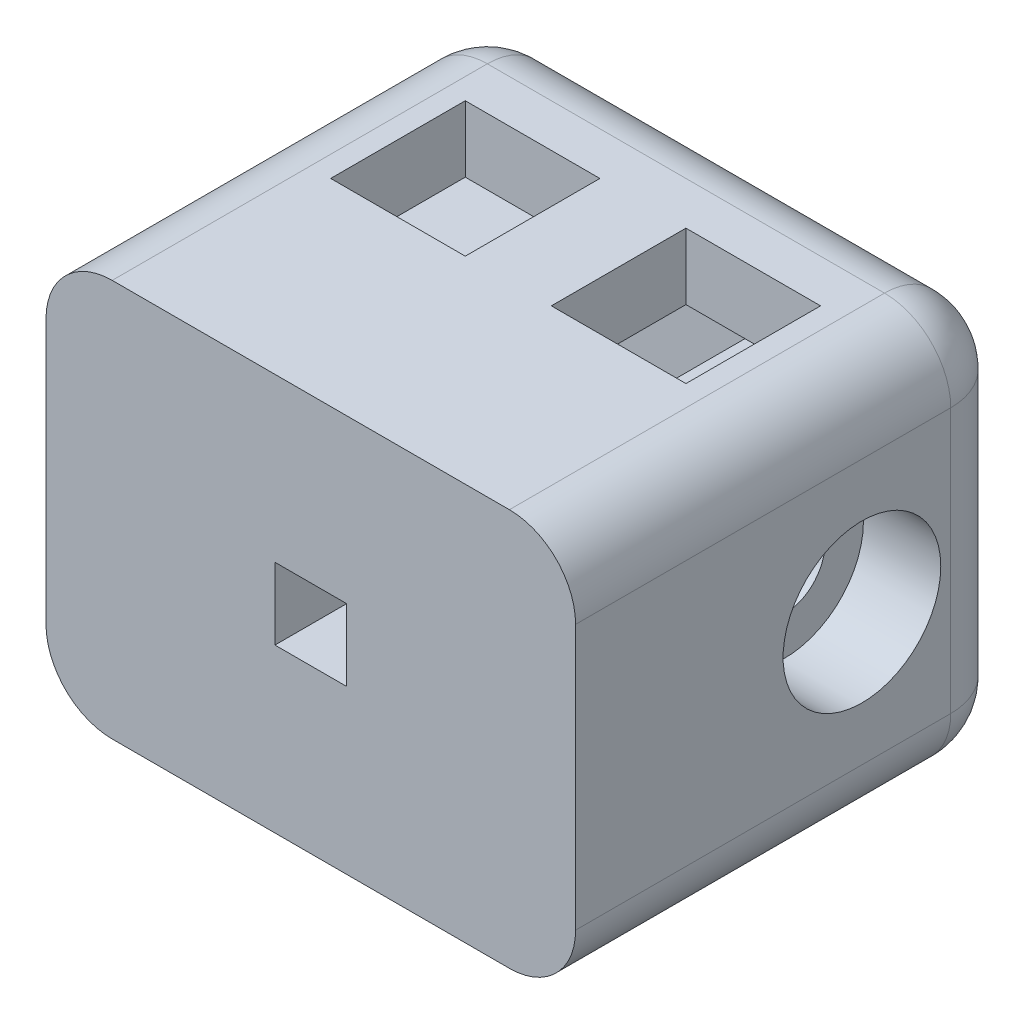
from build123d import *

# Parameters (mm, degrees)
SKETCH1_W                                      = 24
SKETCH1_H                                      = 18
SKETCH1_W_2                                    = 3.25
SKETCH1_H_2                                    = 3.25
BOSS_EXTRUDE1_DEPTH                            = 20
FILLET1_R                                      = 3
SKETCH2_W                                      = 6.1
SKETCH2_H                                      = 6.1
CUT_EXTRUDE1_DEPTH                             = 3
SKETCH3_W                                      = 9.25
SKETCH3_H                                      = 8.1
CUT_EXTRUDE2_DEPTH                             = 28.730849248
SKETCH4_W                                      = 3.25
SKETCH4_H                                      = 3.25
BOSS_EXTRUDE2_DEPTH                            = 2.95
CBORE_FOR_6_SOCKET_HEAD_CAP_SCREW1_D           = 3.6576
CBORE_FOR_6_SOCKET_HEAD_CAP_SCREW1_CBORE_D     = 7.14502
CBORE_FOR_6_SOCKET_HEAD_CAP_SCREW1_CBORE_DEPTH = 3.5052


with BuildPart() as part:
    # Sketch1 → Boss-Extrude1 (new body)
    # profile 1 of 2: a face of its own
    with BuildSketch(Plane.XY):
        Rectangle(SKETCH1_W, SKETCH1_H)
        Rectangle(SKETCH1_W_2, SKETCH1_H_2, mode=Mode.SUBTRACT)
    # profile 2 of 2: a face of its own
    with BuildSketch(Plane.XY):
        Polygon((-1.625, -1.625), (-1.625, 1.625), (-1.625, 4), (-4.8, 4), (-4.8, -4), (-1.625, -4), align=None)
    extrude(amount=BOSS_EXTRUDE1_DEPTH)

    # Fillet1
    fillet1_edges = [part.edges().sort_by_distance(p)[0] for p in [
        (12, 0, 0),
        (0, -9, 0),
        (-12, -9, 10),
        (-12, 9, 10),
        (12, 9, 10),
        (12, -9, 10),
        (-12, 0, 0),
        (0, 9, 0),
    ]]
    fillet(fillet1_edges, radius=FILLET1_R)

    # Sketch2 → Cut-Extrude1 (cut)
    with BuildSketch(Plane(origin=(0, 9, 0), x_dir=(1, 0, 0), z_dir=(0, 1, 0))):
        with Locations((-5, -8)):
            Rectangle(SKETCH2_W, SKETCH2_H)
        with Locations((5, -8)):
            Rectangle(SKETCH2_W, SKETCH2_H)
    extrude(amount=-CUT_EXTRUDE1_DEPTH, mode=Mode.SUBTRACT)

    # Sketch3 → Cut-Extrude2 (cut, through all)
    with BuildSketch(Plane(origin=(0, 6, 0), x_dir=(1, 0, 0), z_dir=(0, 1, 0))):
        with Locations((0, -7)):
            Rectangle(SKETCH3_W, SKETCH3_H)
    extrude(amount=-CUT_EXTRUDE2_DEPTH, mode=Mode.SUBTRACT)

    # Sketch4 → Boss-Extrude2 (add)
    with BuildSketch(Plane(origin=(0, 0, 0), x_dir=(-1, 0, 0), z_dir=(0, 0, -1))):
        Rectangle(SKETCH4_W, SKETCH4_H)
    extrude(amount=-BOSS_EXTRUDE2_DEPTH)

    # CBORE for #6 Socket Head Cap Screw1 (through all)
    with Locations(Plane(origin=(12, 0, 0), x_dir=(0, 0, -1), z_dir=(1, 0, 0))):
        with Locations((-7.025, 0)):
            CounterBoreHole(CBORE_FOR_6_SOCKET_HEAD_CAP_SCREW1_D / 2, CBORE_FOR_6_SOCKET_HEAD_CAP_SCREW1_CBORE_D / 2, CBORE_FOR_6_SOCKET_HEAD_CAP_SCREW1_CBORE_DEPTH)


solid = part.part
